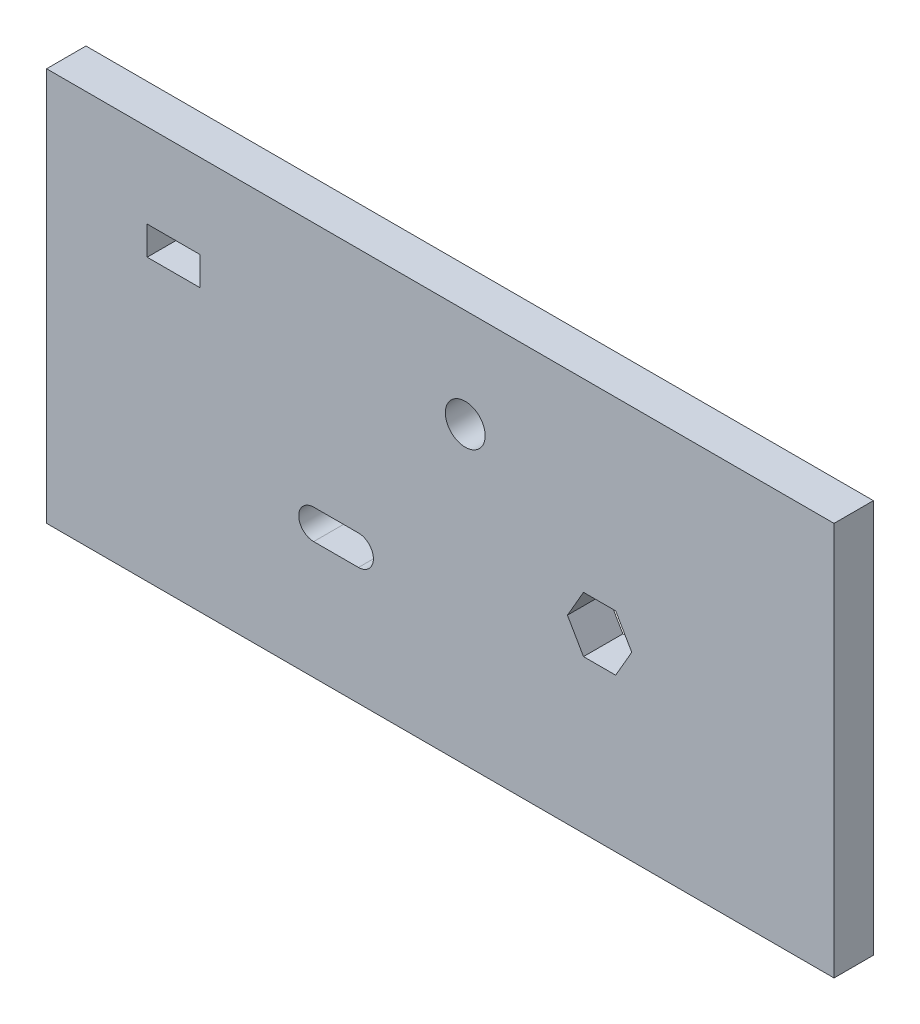
from build123d import *

# Parameters (mm, degrees)
SKETCH1_W           = 200
SKETCH1_H           = 100
BOSS_EXTRUDE1_DEPTH = 10
SKETCH2_R           = 5.053404716
SKETCH2_W           = 13.415300493
SKETCH2_H           = 7.29092418
CUT_EXTRUDE1_DEPTH  = 10


with BuildPart() as part:
    # Sketch1 → Boss-Extrude1 (new body)
    with BuildSketch(Plane.XY):
        with Locations((-100, 50)):
            Rectangle(SKETCH1_W, SKETCH1_H)
    extrude(amount=BOSS_EXTRUDE1_DEPTH)

    # Sketch2 → Cut-Extrude1 (cut)
    with BuildSketch(Plane.XY.offset(10)):
        with Locations((-93.667207309, 74.96711448)):
            Circle(SKETCH2_R)
        with Locations((-167.742996984, 74.96711448)):
            Rectangle(SKETCH2_W, SKETCH2_H)
        with BuildLine():
            Line((-132.163286982, 37.491764192), (-120.789445261, 37.491764192))
            ThreePointArc((-120.789445261, 37.491764192), (-116.998164687, 33.700483618), (-120.789445261, 29.909203044))
            Line((-120.789445261, 29.909203044), (-132.163286982, 29.909203044))
            ThreePointArc((-132.163286982, 29.909203044), (-135.954567556, 33.700483618), (-132.163286982, 37.491764192))
        make_face()
        Polygon((-51.379847062, 45.949236241), (-55.462764603, 53.021056866), (-63.628599685, 53.021056866), (-67.711517226, 45.949236241), (-63.628599685, 38.877415617), (-55.462764603, 38.877415617), align=None)
    extrude(amount=-CUT_EXTRUDE1_DEPTH, mode=Mode.SUBTRACT)


solid = part.part
